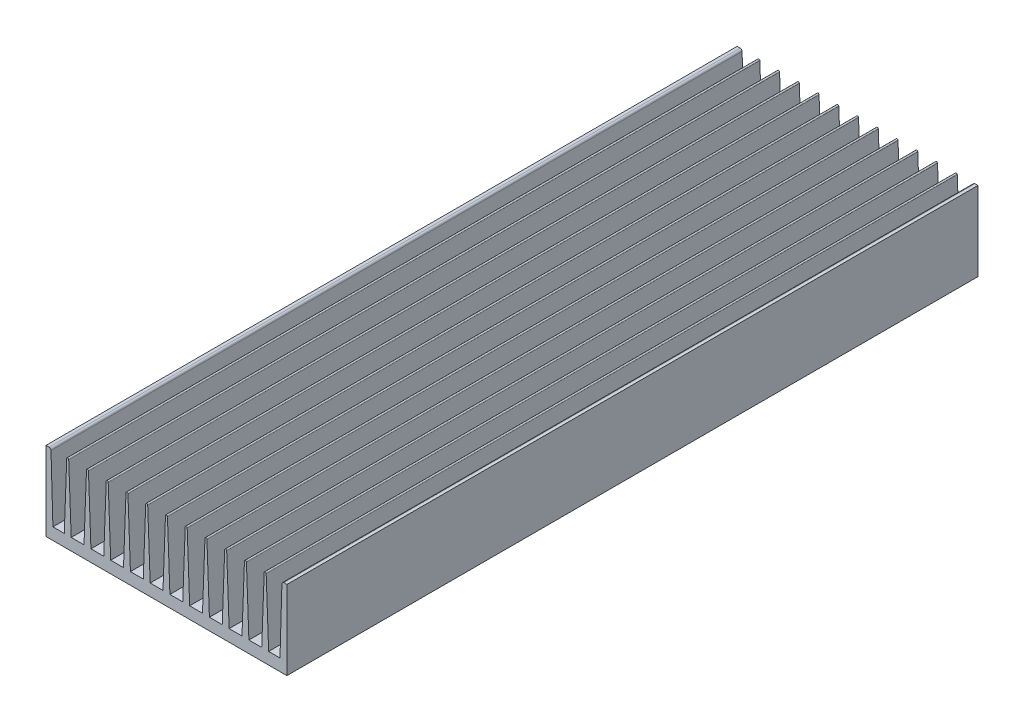
from build123d import *

# Parameters (mm, degrees)
EXTRUDE_1_DEPTH       = 350
EXTRUDE_3_DEPTH       = 350
PATTERN_CURVE_1_COUNT = 11
PATTERN_CURVE_1_PITCH = 10
SKETCH_3_R            = 2.25
CUT_EXTRUDE_1_DEPTH   = 6
SKETCH_4_R            = 2.25
SKETCH_4_R_2          = 1.6
CUT_EXTRUDE_2_DEPTH   = 6


with BuildPart() as part:
    # Эскиз1 → Вытянуть1 (new body)
    with BuildSketch(Plane.XY):
        with BuildLine():
            Line((0, 40), (1.528979332, 40))
            ThreePointArc((1.528979332, 40), (2.225614441, 39.717425624), (2.528547087, 39.029399052))
            Line((2.528547087, 39.029399052), (3.5, 6))
            Line((3.5, 6), (118.5, 6))
            Line((118.5, 6), (119.471452913, 39.029399052))
            ThreePointArc((119.471452913, 39.029399052), (119.774385559, 39.717425624), (120.471020668, 40))
            Line((120.471020668, 40), (122, 40))
            Line((122, 40), (122, 0))
            Line((122, 0), (0, 0))
            Line((0, 0), (0, 40))
        make_face()
    extrude(amount=EXTRUDE_1_DEPTH)

    # Эскиз2 → Вытянуть3 (add)
    with BuildSketch(Plane.XY.offset(350)):
        with BuildLine():
            Line((10.5, 39.5), (9.25, 6))
            Line((9.25, 6), (12.75, 6))
            Line((12.75, 6), (11.5, 39.5))
            ThreePointArc((11.5, 39.5), (11, 40), (10.5, 39.5))
        make_face()
    extrude_3 = extrude(amount=-EXTRUDE_3_DEPTH)

    # Кривая1: Вытянуть3 ×11
    with Locations(*[(i * PATTERN_CURVE_1_PITCH, 0, 0) for i in range(1, PATTERN_CURVE_1_COUNT)]):
        add(extrude_3)

    # Эскиз3 → Вырез-Вытянуть1 (cut)
    with BuildSketch(Plane.XZ):
        with Locations((26, 342)):
            Circle(SKETCH_3_R)
        with Locations((96, 342)):
            Circle(SKETCH_3_R)
        with Locations(Location((96, 8, 0), (0, 0, 180))):
            Circle(SKETCH_3_R)
        with Locations(Location((26, 8, 0), (0, 0, 180))):
            Circle(SKETCH_3_R)
    extrude(amount=-CUT_EXTRUDE_1_DEPTH, mode=Mode.SUBTRACT)

    # Эскиз4 → Вырез-Вытянуть2 (cut)
    with BuildSketch(Plane.XZ):
        with Locations((12.5, 40)):
            Circle(SKETCH_4_R)
        with Locations((12.5, 92)):
            Circle(SKETCH_4_R)
        with Locations((32, 25)):
            Circle(SKETCH_4_R_2)
        with Locations((80, 25)):
            Circle(SKETCH_4_R_2)
        with Locations((80, 91)):
            Circle(SKETCH_4_R_2)
        with Locations((32, 91)):
            Circle(SKETCH_4_R_2)
        with Locations((37.5, 115)):
            Circle(SKETCH_4_R_2)
        with Locations((37.5, 255)):
            Circle(SKETCH_4_R_2)
        with Locations((72, 128)):
            Circle(SKETCH_4_R_2)
        with Locations((72, 195)):
            Circle(SKETCH_4_R_2)
        with Locations((26, 295)):
            Circle(SKETCH_4_R)
        with Locations((26, 320)):
            Circle(SKETCH_4_R)
    extrude(amount=-CUT_EXTRUDE_2_DEPTH, mode=Mode.SUBTRACT)


solid = part.part
